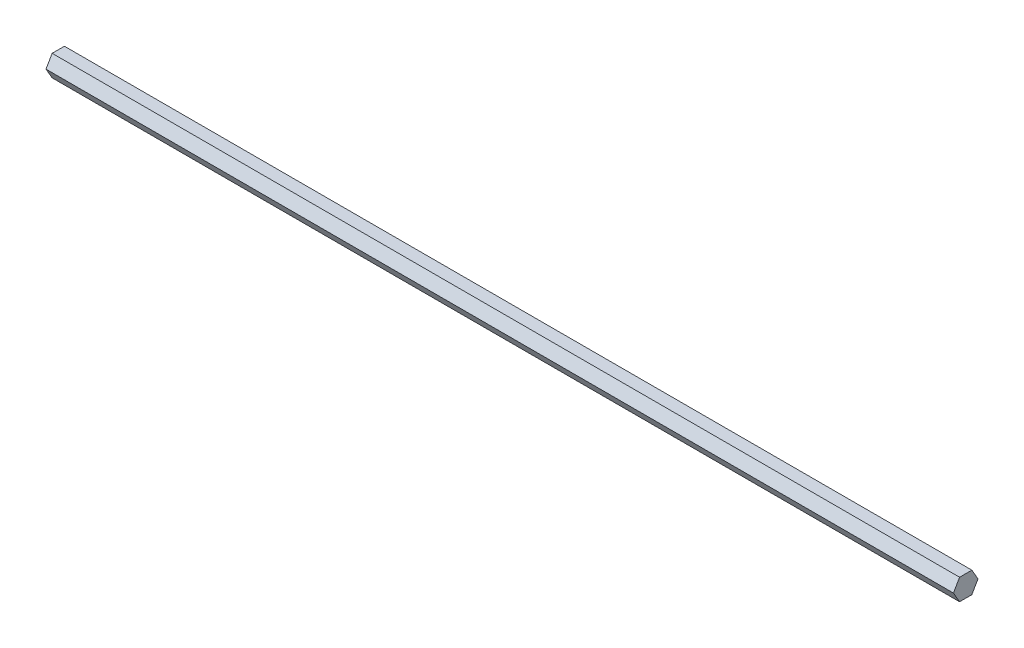
from build123d import *

# Parameters (mm, degrees)
BOSS_EXTRUDE1_DEPTH = 406.4


with BuildPart() as part:
    # Sketch1 → Boss-Extrude1 (new body)
    with BuildSketch(Plane(origin=(0, 0, 0), x_dir=(0, 0, -1), z_dir=(1, 0, 0))):
        Polygon((5.499261314, 0), (2.749630657, 4.7625), (-2.749630657, 4.7625), (-5.499261314, 0), (-2.749630657, -4.7625), (2.749630657, -4.7625), align=None)
    extrude(amount=BOSS_EXTRUDE1_DEPTH)


solid = part.part
